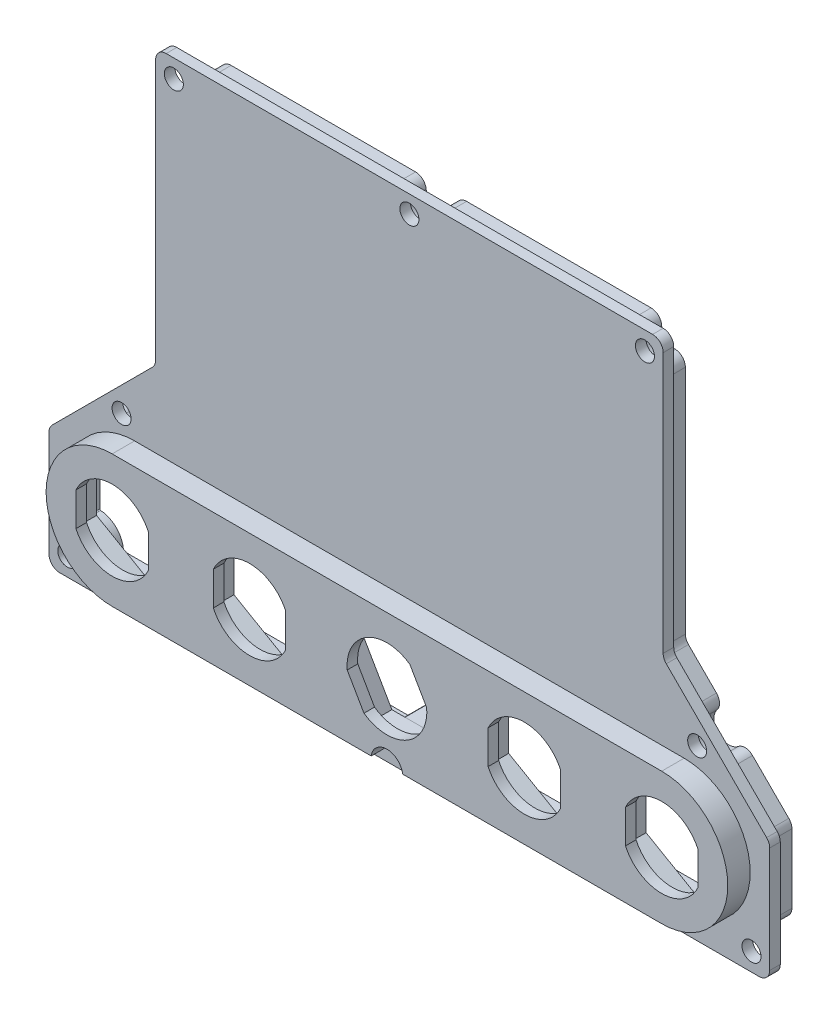
from build123d import *

# Parameters (mm, degrees)
SKETCH1_W           = 88.855
SKETCH1_H           = 25.105
BOSS_EXTRUDE1_DEPTH = 4
SKETCH1_5_R         = 1.8
BOSS_EXTRUDE3_DEPTH = 2
BOSS_EXTRUDE4_DEPTH = 2.25
BOSS_EXTRUDE5_DEPTH = 2


with BuildPart() as part:
    # Sketch1 → Boss-Extrude1 (new body)
    with BuildSketch(Plane.XY):
        with BuildLine():
            Line((47.729682903, -13.588708514), (12.809883707, -13.588708514))
            ThreePointArc((12.809883707, -13.588708514), (11.448191822, -14.123855207), (10.815204846, -15.442913302))
            ThreePointArc((10.815204846, -15.442913302), (9.988041797, -17.25040945), (8.180545648, -18.0775725))
            ThreePointArc((8.180545648, -18.0775725), (6.861487553, -18.710559476), (6.326340861, -20.07225136))
            Line((6.326340861, -20.07225136), (6.326340861, -63.808793529))
            ThreePointArc((6.326340861, -63.808793529), (6.174099926, -64.574160393), (5.740554423, -65.223007091))
            Line((5.740554423, -65.223007091), (0.436648028, -70.526913486))
            ThreePointArc((0.436648028, -70.526913486), (-0.146472505, -71.837896664), (0.298388107, -73.202010106))
            ThreePointArc((0.298388107, -73.202010106), (0.101367721, -77.01402279), (-3.710644963, -77.211043177))
            ThreePointArc((-3.710644963, -77.211043177), (-5.074758405, -76.766182564), (-6.385741583, -77.349303097))
            Line((-6.385741583, -77.349303097), (-13.255177547, -84.218739061))
            ThreePointArc((-13.255177547, -84.218739061), (-13.68872305, -84.867585759), (-13.840963985, -85.632952624))
            Line((-13.840963985, -85.632952624), (-13.840963985, -98.677765048))
            ThreePointArc((-13.840963985, -98.677765048), (-13.306003678, -100.039256399), (-11.987305288, -100.672403919))
            ThreePointArc((-11.987305288, -100.672403919), (-10.18166322, -101.49901744), (-9.355049698, -103.304659508))
            ThreePointArc((-9.355049698, -103.304659508), (-8.721902178, -104.623357898), (-7.360410828, -105.158318205))
            Line((-7.360410828, -105.158318205), (47.727182903, -105.158318205))
            ThreePointArc((47.727182903, -105.158318205), (49.066516481, -104.643641593), (49.716526391, -103.364503772))
            ThreePointArc((49.716526391, -103.364503772), (52.551340861, -100.808318205), (55.386155331, -103.364503772))
            ThreePointArc((55.386155331, -103.364503772), (56.03616524, -104.643641593), (57.375498818, -105.158318205))
            Line((57.375498818, -105.158318205), (112.46010286, -105.158318205))
            ThreePointArc((112.46010286, -105.158318205), (113.821794745, -104.623171513), (114.454781721, -103.304113418))
            ThreePointArc((114.454781721, -103.304113418), (115.28194477, -101.496617269), (117.089440919, -100.66945422))
            ThreePointArc((117.089440919, -100.66945422), (118.408499014, -100.036467243), (118.943645706, -98.674775359))
            Line((118.943645706, -98.674775359), (118.943645706, -85.632952624))
            ThreePointArc((118.943645706, -85.632952624), (118.791404771, -84.867585759), (118.357859269, -84.218739061))
            Line((118.357859269, -84.218739061), (111.488423304, -77.349303097))
            ThreePointArc((111.488423304, -77.349303097), (110.177440127, -76.766182564), (108.813326684, -77.211043177))
            ThreePointArc((108.813326684, -77.211043177), (105.001314001, -77.01402279), (104.804293614, -73.202010106))
            ThreePointArc((104.804293614, -73.202010106), (105.249154227, -71.837896664), (104.666033694, -70.526913486))
            Line((104.666033694, -70.526913486), (99.367127298, -65.228007091))
            ThreePointArc((99.367127298, -65.228007091), (98.933581796, -64.579160393), (98.781340861, -63.813793529))
            Line((98.781340861, -63.813793529), (98.781340861, -20.07225136))
            ThreePointArc((98.781340861, -20.07225136), (98.246194168, -18.710559476), (96.927136073, -18.0775725))
            ThreePointArc((96.927136073, -18.0775725), (95.119639925, -17.25040945), (94.292476875, -15.442913302))
            ThreePointArc((94.292476875, -15.442913302), (93.659489899, -14.123855207), (92.297798015, -13.588708514))
            Line((92.297798015, -13.588708514), (57.377998818, -13.588708514))
            ThreePointArc((57.377998818, -13.588708514), (56.03866524, -14.103385126), (55.388655331, -15.382522947))
            ThreePointArc((55.388655331, -15.382522947), (52.553840861, -17.938708514), (49.719026391, -15.382522947))
            ThreePointArc((49.719026391, -15.382522947), (49.069016481, -14.103385126), (47.729682903, -13.588708514))
        make_face()
        with Locations((52.553840861, -46.641208514)):
            Rectangle(SKETCH1_W, SKETCH1_H, mode=Mode.SUBTRACT)
        with BuildLine():
            Line((96.981340861, -32.288708514), (8.126340861, -32.288708514))
            Line((8.126340861, -32.288708514), (8.126340861, -20.07225136))
            ThreePointArc((8.126340861, -20.07225136), (8.17985553, -19.936082172), (8.311761339, -19.872783474))
            ThreePointArc((8.311761339, -19.872783474), (11.260834003, -18.523201656), (12.61041582, -15.574128993))
            ThreePointArc((12.61041582, -15.574128993), (12.673714518, -15.442223183), (12.809883707, -15.388708514))
            Line((12.809883707, -15.388708514), (47.729682903, -15.388708514))
            ThreePointArc((47.729682903, -15.388708514), (47.863616261, -15.440176175), (47.928617252, -15.568089957))
            ThreePointArc((47.928617252, -15.568089957), (52.553840861, -19.738708514), (57.17906447, -15.568089957))
            ThreePointArc((57.17906447, -15.568089957), (57.244065461, -15.440176175), (57.377998818, -15.388708514))
            Line((57.377998818, -15.388708514), (92.297798015, -15.388708514))
            ThreePointArc((92.297798015, -15.388708514), (92.433967203, -15.442223183), (92.497265901, -15.574128993))
            ThreePointArc((92.497265901, -15.574128993), (93.846847719, -18.523201656), (96.795920382, -19.872783474))
            ThreePointArc((96.795920382, -19.872783474), (96.927826191, -19.936082172), (96.981340861, -20.07225136))
            Line((96.981340861, -20.07225136), (96.981340861, -32.288708514))
        make_face(mode=Mode.SUBTRACT)
        with BuildLine():
            Line((96.981340861, -60.993708514), (8.126340861, -60.993708514))
            Line((8.126340861, -60.993708514), (8.126340861, -63.808793529))
            ThreePointArc((8.126340861, -63.808793529), (7.837083084, -65.262990572), (7.013346629, -66.495799297))
            Line((7.013346629, -66.495799297), (1.709440234, -71.799705693))
            ThreePointArc((1.709440234, -71.799705693), (1.651128181, -71.93080401), (1.695614242, -72.067215355))
            ThreePointArc((1.695614242, -72.067215355), (1.374159927, -78.286814996), (-4.845439715, -78.608269311))
            ThreePointArc((-4.845439715, -78.608269311), (-4.981851059, -78.56378325), (-5.112949377, -78.622095303))
            Line((-5.112949377, -78.622095303), (-11.982385341, -85.491531267))
            ThreePointArc((-11.982385341, -85.491531267), (-12.025739891, -85.556415937), (-12.040963985, -85.632952624))
            Line((-12.040963985, -85.632952624), (-12.040963985, -98.677765048))
            ThreePointArc((-12.040963985, -98.677765048), (-11.987467954, -98.813914183), (-11.855598115, -98.877228935))
            ThreePointArc((-11.855598115, -98.877228935), (-8.908871014, -100.226225234), (-7.559874715, -103.172952335))
            ThreePointArc((-7.559874715, -103.172952335), (-7.496559963, -103.304822174), (-7.360410828, -103.358318205))
            Line((-7.360410828, -103.358318205), (47.727182903, -103.358318205))
            ThreePointArc((47.727182903, -103.358318205), (47.861116261, -103.306850544), (47.926117252, -103.178936762))
            ThreePointArc((47.926117252, -103.178936762), (48.491342812, -101.391400508), (49.716526391, -99.972354705))
            Line((49.716526391, -99.972354705), (55.386155331, -99.972354705))
            ThreePointArc((55.386155331, -99.972354705), (56.611338909, -101.391400508), (57.17656447, -103.178936762))
            ThreePointArc((57.17656447, -103.178936762), (57.241565461, -103.306850544), (57.375498818, -103.358318205))
            Line((57.375498818, -103.358318205), (112.46010286, -103.358318205))
            ThreePointArc((112.46010286, -103.358318205), (112.596272049, -103.304803536), (112.659570746, -103.172897726))
            ThreePointArc((112.659570746, -103.172897726), (114.009152564, -100.223825063), (116.958225227, -98.874243245))
            ThreePointArc((116.958225227, -98.874243245), (117.090131037, -98.810944548), (117.143645706, -98.674775359))
            Line((117.143645706, -98.674775359), (117.143645706, -85.632952624))
            ThreePointArc((117.143645706, -85.632952624), (117.128421613, -85.556415937), (117.085067062, -85.491531267))
            Line((117.085067062, -85.491531267), (110.215631098, -78.622095303))
            ThreePointArc((110.215631098, -78.622095303), (110.084532781, -78.56378325), (109.948121436, -78.608269311))
            ThreePointArc((109.948121436, -78.608269311), (103.728521795, -78.286814996), (103.40706748, -72.067215355))
            ThreePointArc((103.40706748, -72.067215355), (103.451553541, -71.93080401), (103.393241488, -71.799705693))
            Line((103.393241488, -71.799705693), (98.094335092, -66.500799297))
            ThreePointArc((98.094335092, -66.500799297), (97.270598637, -65.267990572), (96.981340861, -63.813793529))
            Line((96.981340861, -63.813793529), (96.981340861, -60.993708514))
        make_face(mode=Mode.SUBTRACT)
    extrude(amount=-BOSS_EXTRUDE1_DEPTH)

    # Sketch1<5> → Boss-Extrude3 (add)
    with BuildSketch(Plane.XY):
        with BuildLine():
            Line((-15.640963985, -84.887368211), (-15.640963985, -104.958318205))
            ThreePointArc((-15.640963985, -104.958318205), (-15.055177547, -106.372531767), (-13.640963985, -106.958318205))
            Line((-13.640963985, -106.958318205), (118.743645706, -106.958318205))
            ThreePointArc((118.743645706, -106.958318205), (120.157859269, -106.372531767), (120.743645706, -104.958318205))
            Line((120.743645706, -104.958318205), (120.743645706, -84.887368211))
            ThreePointArc((120.743645706, -84.887368211), (120.591404771, -84.122001347), (120.157859269, -83.473154649))
            Line((120.157859269, -83.473154649), (101.167127298, -64.482422679))
            ThreePointArc((101.167127298, -64.482422679), (100.733581796, -63.833575981), (100.581340861, -63.068209116))
            Line((100.581340861, -63.068209116), (100.581340861, -13.788708514))
            ThreePointArc((100.581340861, -13.788708514), (99.995554423, -12.374494952), (98.581340861, -11.788708514))
            Line((98.581340861, -11.788708514), (6.526340861, -11.788708514))
            ThreePointArc((6.526340861, -11.788708514), (5.112127298, -12.374494952), (4.526340861, -13.788708514))
            Line((4.526340861, -13.788708514), (4.526340861, -63.063209116))
            ThreePointArc((4.526340861, -63.063209116), (4.374099926, -63.828575981), (3.940554423, -64.477422679))
            Line((3.940554423, -64.477422679), (-15.055177547, -83.473154649))
            ThreePointArc((-15.055177547, -83.473154649), (-15.48872305, -84.122001347), (-15.640963985, -84.887368211))
        make_face()
        with Locations((-12.195717461, -103.513071681)):
            Circle(SKETCH1_5_R, mode=Mode.SUBTRACT)
        with Locations((-1.913886606, -74.998768464)):
            Circle(SKETCH1_5_R, mode=Mode.SUBTRACT)
        with Locations((52.551340861, -103.658318205)):
            Circle(SKETCH1_5_R, mode=Mode.SUBTRACT)
        with Locations((117.297199097, -103.511871596)):
            Circle(SKETCH1_5_R, mode=Mode.SUBTRACT)
        with Locations((107.016568327, -74.998768464)):
            Circle(SKETCH1_5_R, mode=Mode.SUBTRACT)
        with Locations((7.97278747, -15.235155124)):
            Circle(SKETCH1_5_R, mode=Mode.SUBTRACT)
        with Locations((52.553840861, -15.088708514)):
            Circle(SKETCH1_5_R, mode=Mode.SUBTRACT)
        with Locations((97.134894251, -15.235155124)):
            Circle(SKETCH1_5_R, mode=Mode.SUBTRACT)
        Polygon((78.551340861, -101.389258313), (69.351340861, -96.077635836), (69.351340861, -85.454390883), (78.551340861, -80.142768406), (87.751340861, -85.454390883), (87.751340861, -96.077635836), align=None, mode=Mode.SUBTRACT)
        Polygon((63.176890659, -90.76601336), (57.865268183, -99.96601336), (47.24202323, -99.96601336), (41.930400753, -90.76601336), (47.24202323, -81.56601336), (57.865268183, -81.56601336), align=None, mode=Mode.SUBTRACT)
        Polygon((17.351340861, -96.077635836), (17.351340861, -85.454390883), (26.551340861, -80.142768406), (35.751340861, -85.454390883), (35.751340861, -96.077635836), (26.551340861, -101.389258313), align=None, mode=Mode.SUBTRACT)
        Polygon((9.751340861, -85.454390883), (9.751340861, -96.077635836), (0.551340861, -101.389258313), (-8.648659139, -96.077635836), (-8.648659139, -85.454390883), (0.551340861, -80.142768406), align=None, mode=Mode.SUBTRACT)
        Polygon((113.751340861, -85.454390883), (113.751340861, -96.077635836), (104.551340861, -101.389258313), (95.351340861, -96.077635836), (95.351340861, -85.454390883), (104.551340861, -80.142768406), align=None, mode=Mode.SUBTRACT)
    extrude(amount=BOSS_EXTRUDE3_DEPTH)

    # Sketch2 → Boss-Extrude4 (add)
    with BuildSketch(Plane.XY.offset(2)):
        with BuildLine():
            ThreePointArc((55.52557974, -103.26601336), (52.551340861, -100.658318205), (49.577101982, -103.26601336))
            Line((49.577101982, -103.26601336), (0.551340861, -103.26601336))
            ThreePointArc((0.551340861, -103.26601336), (-11.948659139, -90.76601336), (0.551340861, -78.26601336))
            Line((0.551340861, -78.26601336), (104.551340861, -78.26601336))
            ThreePointArc((104.551340861, -78.26601336), (117.051340861, -90.76601336), (104.551340861, -103.26601336))
            Line((104.551340861, -103.26601336), (55.52557974, -103.26601336))
        make_face()
        Polygon((95.351340861, -96.077635836), (95.351340861, -85.454390883), (104.551340861, -80.142768406), (113.751340861, -85.454390883), (113.751340861, -96.077635836), (104.551340861, -101.389258313), align=None, mode=Mode.SUBTRACT)
        Polygon((78.551340861, -101.389258313), (69.351340861, -96.077635836), (69.351340861, -85.454390883), (78.551340861, -80.142768406), (87.751340861, -85.454390883), (87.751340861, -96.077635836), align=None, mode=Mode.SUBTRACT)
        Polygon((47.24202323, -99.96601336), (41.930400753, -90.76601336), (47.24202323, -81.56601336), (57.865268183, -81.56601336), (63.176890659, -90.76601336), (57.865268183, -99.96601336), align=None, mode=Mode.SUBTRACT)
        Polygon((17.351340861, -96.077635836), (17.351340861, -85.454390883), (26.551340861, -80.142768406), (35.751340861, -85.454390883), (35.751340861, -96.077635836), (26.551340861, -101.389258313), align=None, mode=Mode.SUBTRACT)
        Polygon((0.551340861, -101.389258313), (-8.648659139, -96.077635836), (-8.648659139, -85.454390883), (0.551340861, -80.142768406), (9.751340861, -85.454390883), (9.751340861, -96.077635836), align=None, mode=Mode.SUBTRACT)
    extrude(amount=BOSS_EXTRUDE4_DEPTH)

    # Sketch3 → Boss-Extrude5 (add)
    # profile 1 of 6: a face of its own
    with BuildSketch(Plane.XY.offset(4.25)):
        with BuildLine():
            Line((0.551340861, -103.26601336), (49.577101982, -103.26601336))
            ThreePointArc((49.577101982, -103.26601336), (52.551340861, -100.658318205), (55.52557974, -103.26601336))
            Line((55.52557974, -103.26601336), (104.551340861, -103.26601336))
            ThreePointArc((104.551340861, -103.26601336), (117.051340861, -90.76601336), (104.551340861, -78.26601336))
            Line((104.551340861, -78.26601336), (0.551340861, -78.26601336))
            ThreePointArc((0.551340861, -78.26601336), (-11.948659139, -90.76601336), (0.551340861, -103.26601336))
        make_face()
        Polygon((104.551340861, -101.389258313), (95.351340861, -96.077635836), (95.351340861, -85.454390883), (104.551340861, -80.142768406), (113.751340861, -85.454390883), (113.751340861, -96.077635836), align=None, mode=Mode.SUBTRACT)
        Polygon((87.751340861, -96.077635836), (78.551340861, -101.389258313), (69.351340861, -96.077635836), (69.351340861, -85.454390883), (78.551340861, -80.142768406), (87.751340861, -85.454390883), align=None, mode=Mode.SUBTRACT)
        Polygon((57.865268183, -99.96601336), (47.24202323, -99.96601336), (41.930400753, -90.76601336), (47.24202323, -81.56601336), (57.865268183, -81.56601336), (63.176890659, -90.76601336), align=None, mode=Mode.SUBTRACT)
        Polygon((26.551340861, -101.389258313), (17.351340861, -96.077635836), (17.351340861, -85.454390883), (26.551340861, -80.142768406), (35.751340861, -85.454390883), (35.751340861, -96.077635836), align=None, mode=Mode.SUBTRACT)
        Polygon((9.751340861, -96.077635836), (0.551340861, -101.389258313), (-8.648659139, -96.077635836), (-8.648659139, -85.454390883), (0.551340861, -80.142768406), (9.751340861, -85.454390883), align=None, mode=Mode.SUBTRACT)
    # profile 2 of 6: a face of its own
    with BuildSketch(Plane.XY.offset(4.25)):
        Polygon((0.551340861, -101.389258313), (-8.648659139, -96.077635836), (-8.648659139, -85.454390883), (0.551340861, -80.142768406), (9.751340861, -85.454390883), (9.751340861, -96.077635836), align=None)
        with BuildLine():
            ThreePointArc((7.401340861, -87.591111786), (0.551340861, -83.21601336), (-6.298659139, -87.591111786))
            Line((-6.298659139, -87.591111786), (-6.298659139, -90.76601336))
            Line((-6.298659139, -90.76601336), (-6.298659139, -93.940914933))
            ThreePointArc((-6.298659139, -93.940914933), (0.551340861, -98.31601336), (7.401340861, -93.940914933))
            Line((7.401340861, -93.940914933), (7.401340861, -90.76601336))
            Line((7.401340861, -90.76601336), (7.401340861, -87.591111786))
        make_face(mode=Mode.SUBTRACT)
    # profile 3 of 6: a face of its own
    with BuildSketch(Plane.XY.offset(4.25)):
        Polygon((17.351340861, -96.077635836), (17.351340861, -85.454390883), (26.551340861, -80.142768406), (35.751340861, -85.454390883), (35.751340861, -96.077635836), (26.551340861, -101.389258313), align=None)
        with BuildLine():
            ThreePointArc((33.401340861, -87.591111786), (26.551340861, -83.21601336), (19.701340861, -87.591111786))
            Line((19.701340861, -87.591111786), (19.701340861, -90.76601336))
            Line((19.701340861, -90.76601336), (19.701340861, -93.940914933))
            ThreePointArc((19.701340861, -93.940914933), (26.551340861, -98.31601336), (33.401340861, -93.940914933))
            Line((33.401340861, -93.940914933), (33.401340861, -90.76601336))
            Line((33.401340861, -90.76601336), (33.401340861, -87.591111786))
        make_face(mode=Mode.SUBTRACT)
    # profile 4 of 6: a face of its own
    with BuildSketch(Plane.XY.offset(4.25)):
        Polygon((47.24202323, -99.96601336), (41.930400753, -90.76601336), (47.24202323, -81.56601336), (57.865268183, -81.56601336), (63.176890659, -90.76601336), (57.865268183, -99.96601336), align=None)
        with BuildLine():
            ThreePointArc((48.208822477, -96.940558777), (56.328645706, -97.304505158), (60.073370509, -90.090558777))
            Line((60.073370509, -90.090558777), (58.485919722, -87.34101336))
            Line((58.485919722, -87.34101336), (56.898468935, -84.591467943))
            ThreePointArc((56.898468935, -84.591467943), (48.778645706, -84.227521561), (45.033920904, -91.441467943))
            Line((45.033920904, -91.441467943), (46.62137169, -94.19101336))
            Line((46.62137169, -94.19101336), (48.208822477, -96.940558777))
        make_face(mode=Mode.SUBTRACT)
    # profile 5 of 6: a face of its own
    with BuildSketch(Plane.XY.offset(4.25)):
        Polygon((78.551340861, -101.389258313), (69.351340861, -96.077635836), (69.351340861, -85.454390883), (78.551340861, -80.142768406), (87.751340861, -85.454390883), (87.751340861, -96.077635836), align=None)
        with BuildLine():
            ThreePointArc((85.401340861, -87.591111786), (78.551340861, -83.21601336), (71.701340861, -87.591111786))
            Line((71.701340861, -87.591111786), (71.701340861, -90.76601336))
            Line((71.701340861, -90.76601336), (71.701340861, -93.940914933))
            ThreePointArc((71.701340861, -93.940914933), (78.551340861, -98.31601336), (85.401340861, -93.940914933))
            Line((85.401340861, -93.940914933), (85.401340861, -90.76601336))
            Line((85.401340861, -90.76601336), (85.401340861, -87.591111786))
        make_face(mode=Mode.SUBTRACT)
    # profile 6 of 6: a face of its own
    with BuildSketch(Plane.XY.offset(4.25)):
        Polygon((95.351340861, -96.077635836), (95.351340861, -85.454390883), (104.551340861, -80.142768406), (113.751340861, -85.454390883), (113.751340861, -96.077635836), (104.551340861, -101.389258313), align=None)
        with BuildLine():
            ThreePointArc((111.401340861, -87.591111786), (104.551340861, -83.21601336), (97.701340861, -87.591111786))
            Line((97.701340861, -87.591111786), (97.701340861, -90.76601336))
            Line((97.701340861, -90.76601336), (97.701340861, -93.940914933))
            ThreePointArc((97.701340861, -93.940914933), (104.551340861, -98.31601336), (111.401340861, -93.940914933))
            Line((111.401340861, -93.940914933), (111.401340861, -90.76601336))
            Line((111.401340861, -90.76601336), (111.401340861, -87.591111786))
        make_face(mode=Mode.SUBTRACT)
    extrude(amount=BOSS_EXTRUDE5_DEPTH)


solid = part.part
